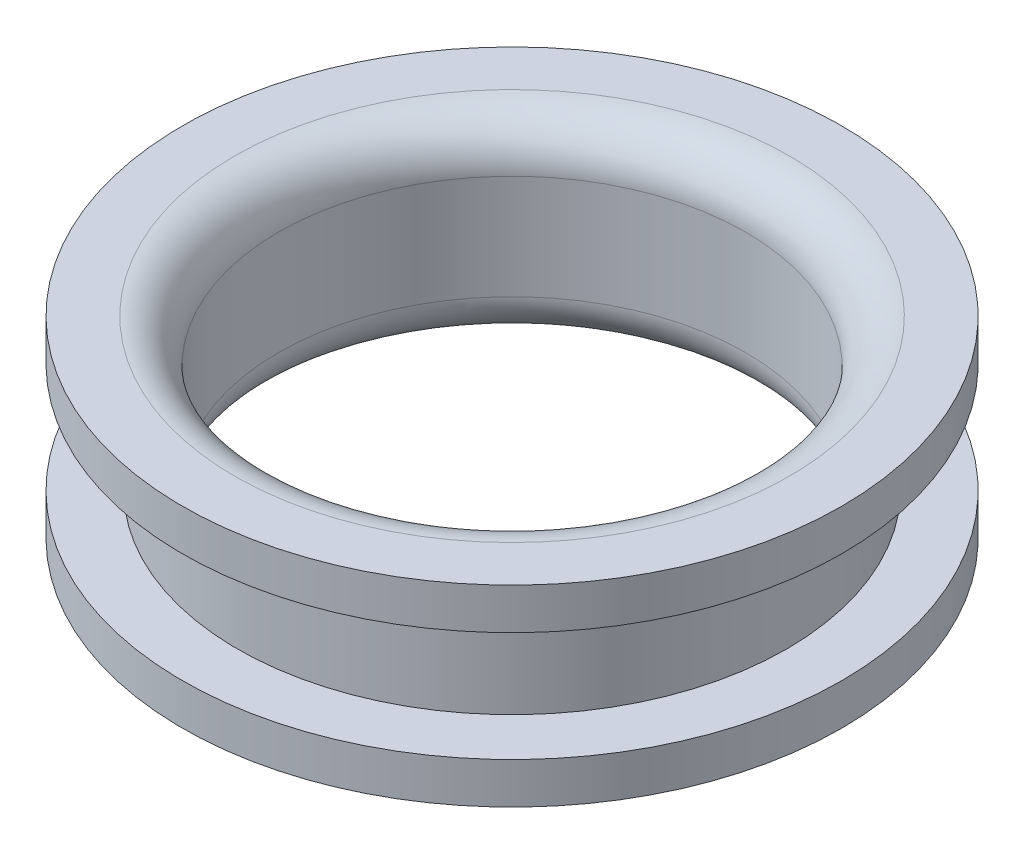
from build123d import *

# Parameters (mm, degrees)
FILLET1_R = 8


with BuildPart() as part:
    # Sketch1 → Revolve1 (revolve)
    with BuildSketch(Plane.XY):
        Polygon((60, 17.5), (42.5, 17.5), (42.5, -17.5), (60, -17.5), (60, -10), (50, -10), (50, 10), (60, 10), align=None)
    revolve(axis=Axis((0, -1019.449736873, 0), (0, 1, 0)))

    # Fillet1
    fillet1_edges = [part.edges().sort_by_distance(p)[0] for p in [
        (-42.5, -17.5, 0),
        (-42.5, 17.5, 0),
    ]]
    fillet(fillet1_edges, radius=FILLET1_R)


solid = part.part
